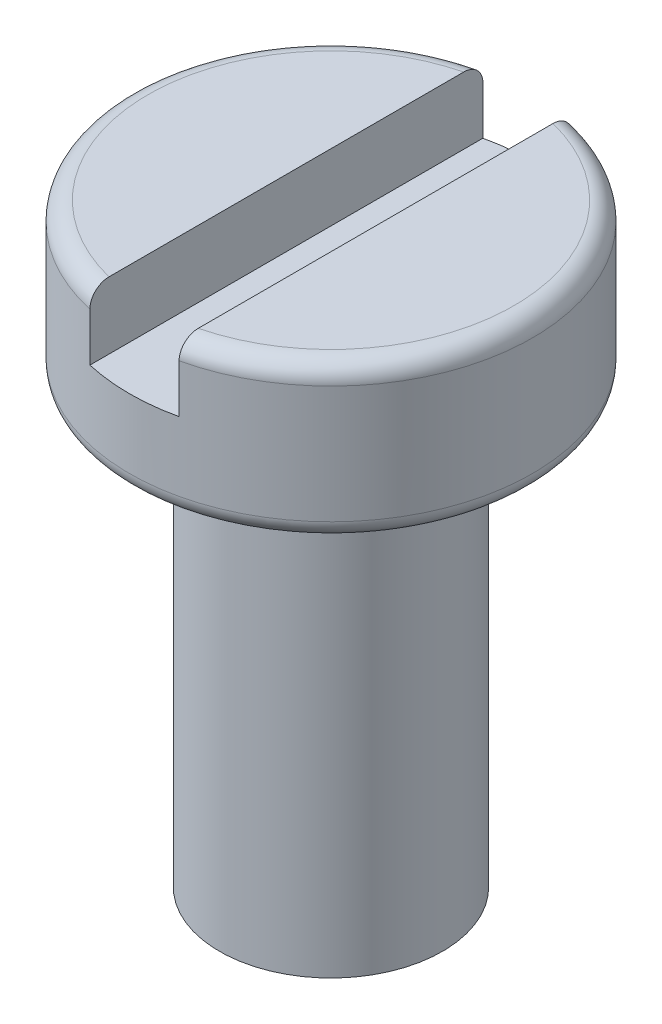
from build123d import *

# Parameters (mm, degrees)
SKETCH1_R             = 2.71
BOSS_EXTRUDE1_DEPTH   = 8
SKETCH2_OUTSIDE_W     = 9.636
SKETCH2_OUTSIDE_H     = 9.636
SKETCH2_OUTSIDE_R     = 1.5
CUT_EXTRUDE1_DEPTH    = 5.92
FILLET1_R             = 0.25
FILLET2_R             = 0.15
SKETCH3_W             = 1.2
SKETCH3_H             = 5.422046684
CUT_EXTRUDE2_DEPTH    = 0.9
BODY_MOVE_COPY1_ANGLE = 180


with BuildPart() as part:
    # Sketch1 → Boss-Extrude1 (new body)
    with BuildSketch(Plane(origin=(0, 0, 0), x_dir=(1, 0, 0), z_dir=(0, 1, 0))):
        with Locations(Location((0, 0, 0), (0, 0, 270))):
            Circle(SKETCH1_R)
    extrude(amount=BOSS_EXTRUDE1_DEPTH)

    # Sketch2 outside → Cut-Extrude1 (cut)
    with BuildSketch(Plane(origin=(0, 8, 0), x_dir=(1, 0, 0), z_dir=(0, 1, 0))):
        Rectangle(SKETCH2_OUTSIDE_W, SKETCH2_OUTSIDE_H)
        with Locations(Location((0, 0, 0), (0, 0, 270))):
            Circle(SKETCH2_OUTSIDE_R, mode=Mode.SUBTRACT)
    extrude(amount=-CUT_EXTRUDE1_DEPTH, mode=Mode.SUBTRACT)

    # Fillet1
    fillet1_edges = [part.edges().sort_by_distance(p)[0] for p in [
        (0, 0, -2.71),
        (0, 2.08, -2.71),
    ]]
    fillet(fillet1_edges, radius=FILLET1_R)

    # Fillet2
    fillet2_edges = [part.edges().sort_by_distance(p)[0] for p in [
        (0, 2.08, -1.5),
    ]]
    fillet(fillet2_edges, radius=FILLET2_R)

    # Sketch3 → Cut-Extrude2 (cut)
    with BuildSketch(Plane.XZ):
        Rectangle(SKETCH3_W, SKETCH3_H)
    extrude(amount=-CUT_EXTRUDE2_DEPTH, mode=Mode.SUBTRACT)


with BuildPart() as part_1:
    # Body-Move/Copy1: moved
    add(part.part.rotate(Axis((0, 10, 0), (1, 0, 0)), BODY_MOVE_COPY1_ANGLE))


solid = part_1.part
